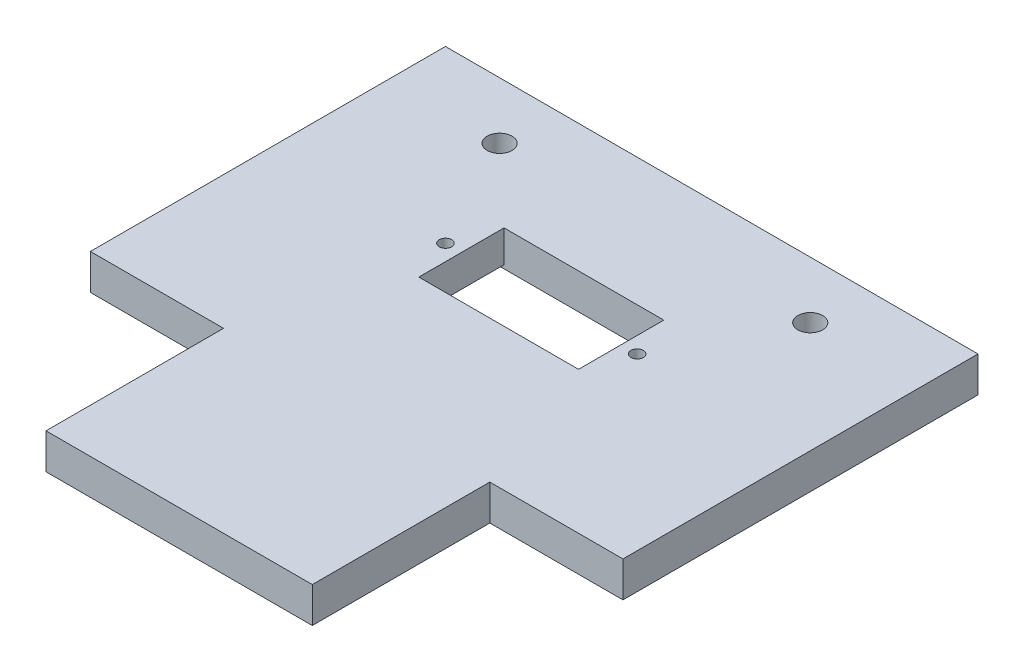
from build123d import *

# Parameters (mm, degrees)
BOSS_EXTRUDE1_DEPTH = 5.08
SKETCH2_R           = 1.778
CUT_EXTRUDE1_DEPTH  = 55.120480412
SKETCH3_W           = 22.86
SKETCH3_H           = 12.192
CUT_EXTRUDE2_DEPTH  = 4.572
SKETCH4_W           = 33.02
SKETCH4_H           = 12.192
CUT_EXTRUDE3_DEPTH  = 0.508
SKETCH5_R           = 0.889
CUT_EXTRUDE4_DEPTH  = 55.075162358


with BuildPart() as part:
    # Sketch1 → Boss-Extrude1 (new body)
    with BuildSketch(Plane(origin=(0, 0, 0), x_dir=(1, 0, 0), z_dir=(0, 1, 0))):
        Polygon((-38.1, -12.7), (-38.1, 38.1), (38.1, 38.1), (38.1, -12.7), (19.05, -12.7), (19.05, -38.1), (-19.05, -38.1), (-19.05, -12.7), align=None)
    extrude(amount=BOSS_EXTRUDE1_DEPTH)

    # Sketch2 → Cut-Extrude1 (cut, through all)
    with BuildSketch(Plane(origin=(0, 5.08, 0), x_dir=(1, 0, 0), z_dir=(0, 1, 0))):
        with Locations(Location((-22.225, 29.972, 0), (0, 0, 270))):
            Circle(SKETCH2_R)
        with Locations(Location((22.225, 29.972, 0), (0, 0, 90))):
            Circle(SKETCH2_R)
    extrude(amount=-CUT_EXTRUDE1_DEPTH, mode=Mode.SUBTRACT)

    # Sketch3 → Cut-Extrude2 (cut)
    with BuildSketch(Plane(origin=(0, 5.08, 0), x_dir=(1, 0, 0), z_dir=(0, 1, 0))):
        with Locations((0, 13.716)):
            Rectangle(SKETCH3_W, SKETCH3_H)
    extrude(amount=-CUT_EXTRUDE2_DEPTH, mode=Mode.SUBTRACT)

    # Sketch4 → Cut-Extrude3 (cut)
    with BuildSketch(Plane.XZ):
        with Locations((0, -13.716)):
            Rectangle(SKETCH4_W, SKETCH4_H)
    extrude(amount=-CUT_EXTRUDE3_DEPTH, mode=Mode.SUBTRACT)

    # Sketch5 → Cut-Extrude4 (cut, through all)
    with BuildSketch(Plane.XZ.offset(-0.508)):
        with Locations(Location((-13.716, -13.716, 0), (0, 0, 270))):
            Circle(SKETCH5_R)
        with Locations(Location((13.716, -13.716, 0), (0, 0, 270))):
            Circle(SKETCH5_R)
    extrude(amount=-CUT_EXTRUDE4_DEPTH, mode=Mode.SUBTRACT)


solid = part.part
